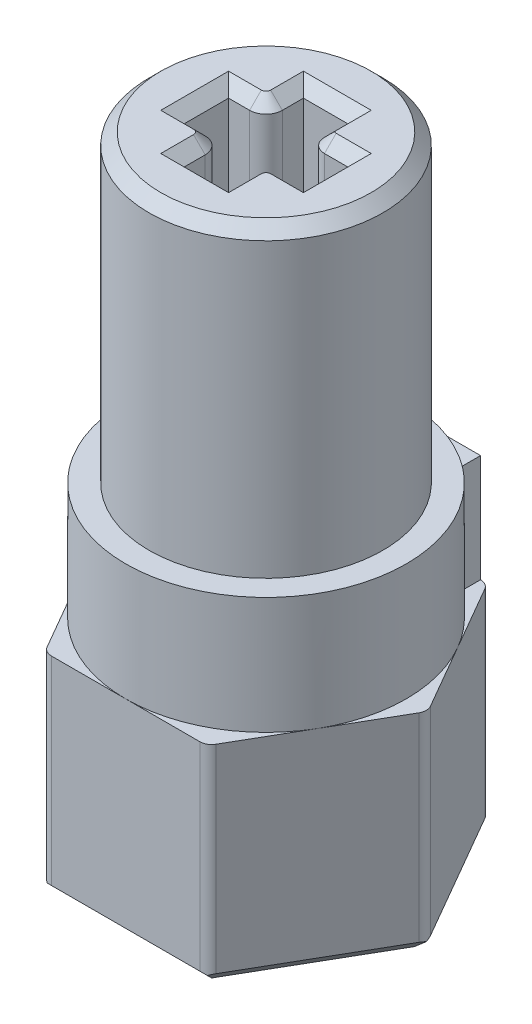
from build123d import *

# Parameters (mm, degrees)
SKETCH_1_R          = 6
EXTRUDE_4_DEPTH     = 18
FILLET_1_R          = 0.6
FILLET_6_R          = 0.7
EXTRUDE_5_DEPTH     = 9
SKETCH_3_R          = 2.55
CUT_EXTRUDE_1_DEPTH = 6
CHAMFER_1_SIZE      = 0.5
FILLET_4_R          = 0.5
FILLET_5_R          = 0.5
SKETCH_4_W          = 6.329239392
SKETCH_4_H          = 4.6
EXTRUDE_6_DEPTH     = 3.45
SKETCH_5_R          = 1.2
CUT_EXTRUDE_2_DEPTH = 3.45
CUT_EXTRUDE_START   = -13
SKETCH_7_R          = 6
SKETCH_7_R_2        = 5
CUT_EXTRUDE_4_DEPTH = 13
CHAMFER_2_SIZE      = 0.5


with BuildPart() as part:
    # ｽｹｯﾁ1 → ﾎﾞｽ - 押し出し4 (new body)
    with BuildSketch(Plane(origin=(0, 0, 0), x_dir=(1, 0, 0), z_dir=(0, 1, 0))):
        with Locations(Location((0, 0, 0), (0, 0, 270))):
            Circle(SKETCH_1_R)
        Polygon((-2.55, -0.95), (-2.55, 0.95), (-0.95, 0.95), (-0.95, 2.55), (0.95, 2.55), (0.95, 0.95), (2.55, 0.95), (2.55, -0.95), (0.95, -0.95), (0.95, -2.55), (-0.95, -2.55), (-0.95, -0.95), align=None, mode=Mode.SUBTRACT)
    extrude(amount=EXTRUDE_4_DEPTH)

    # ﾌｨﾚｯﾄ1
    fillet_1_edges = [part.edges().sort_by_distance(p)[0] for p in [
        (0.95, 9, -0.95),
    ]]
    fillet(fillet_1_edges, radius=FILLET_1_R)

    # ﾌｨﾚｯﾄ6
    fillet_6_edges = [part.edges().sort_by_distance(p)[0] for p in [
        (-0.95, 9, -0.95),
        (-0.95, 9, 0.95),
        (0.95, 9, 0.95),
    ]]
    fillet(fillet_6_edges, radius=FILLET_6_R)

    # ｽｹｯﾁ2 → ﾎﾞｽ - 押し出し5 (add)
    with BuildSketch(Plane.XZ):
        Polygon((6.92820323, 0), (3.464101615, 6), (-3.464101615, 6), (-6.92820323, 0), (-3.464101615, -6), (3.464101615, -6), align=None)
    extrude(amount=EXTRUDE_5_DEPTH)

    # ｽｹｯﾁ3 → ｶｯﾄ - 押し出し1 (cut)
    with BuildSketch(Plane.XZ.offset(9)):
        with Locations(Location((0, 0, 0), (0, 0, 270))):
            Circle(SKETCH_3_R)
    extrude(amount=-CUT_EXTRUDE_1_DEPTH, mode=Mode.SUBTRACT)

    # 面取り1
    chamfer_1_edges = [part.edges().sort_by_distance(p)[0] for p in [
        (0, -9, 2.55),
        (5.196152423, -9, -3),
        (5.196152423, -9, 3),
        (0, -9, 6),
        (-5.196152423, -9, 3),
        (-5.196152423, -9, -3),
        (0, -9, -6),
    ]]
    chamfer(chamfer_1_edges, length=CHAMFER_1_SIZE)

    # ﾌｨﾚｯﾄ4
    fillet_4_edges = [part.edges().sort_by_distance(p)[0] for p in [
        (-3.464101615, -4.25, 6),
    ]]
    fillet(fillet_4_edges, radius=FILLET_4_R)

    # ﾌｨﾚｯﾄ5
    fillet_5_edges = [part.edges().sort_by_distance(p)[0] for p in [
        (3.464101615, -4.25, -6),
        (-3.464101615, -4.25, -6),
        (-6.92820323, -4.25, 0),
        (3.464101615, -4.25, 6),
        (6.92820323, -4.25, 0),
    ]]
    fillet(fillet_5_edges, radius=FILLET_5_R)

    # ｽｹｯﾁ4 → ﾎﾞｽ - 押し出し6 (add)
    with BuildSketch(Plane.XY.offset(-2.55)):
        with Locations((0.010806785, 2.3)):
            Rectangle(SKETCH_4_W, SKETCH_4_H)
    extrude(amount=-EXTRUDE_6_DEPTH)

    # ｽｹｯﾁ5 → ｶｯﾄ - 押し出し2 (cut)
    with BuildSketch(Plane(origin=(0, 0, -6), x_dir=(-1, 0, 0), z_dir=(0, 0, -1))):
        with Locations((0, 2)):
            Circle(SKETCH_5_R)
    extrude(amount=-CUT_EXTRUDE_2_DEPTH, mode=Mode.SUBTRACT)

    # ｽｹｯﾁ7 → ｶｯﾄ - 押し出し4 (cut)
    with BuildSketch(Plane(origin=(0, 18, 0), x_dir=(1, 0, 0), z_dir=(0, 1, 0)).offset(CUT_EXTRUDE_START)):
        with Locations(Location((0, 0, 0), (0, 0, 270))):
            Circle(SKETCH_7_R)
        with Locations(Location((0, 0, 0), (0, 0, 270))):
            Circle(SKETCH_7_R_2, mode=Mode.SUBTRACT)
    extrude(amount=CUT_EXTRUDE_4_DEPTH, mode=Mode.SUBTRACT)

    # 面取り2
    chamfer_2_edges = [part.edges().sort_by_distance(p)[0] for p in [
        (0, 18, -5),
        (2.55, 18, 0),
        (-2.1, 18, -0.95),
        (-2.1, 18, 0.95),
        (-2.55, 18, 0),
        (2.05, 18, -0.95),
        (1.125735931, 18, -1.125735931),
        (-0.95, 18, 2.1),
        (2.1, 18, 0.95),
        (0.95, 18, 2.1),
        (1.155025253, 18, 1.155025253),
        (-1.155025253, 18, -1.155025253),
        (-1.155025253, 18, 1.155025253),
        (0.95, 18, -2.05),
        (0, 18, -2.55),
        (0, 18, 2.55),
        (-0.95, 18, -2.1),
    ]]
    chamfer(chamfer_2_edges, length=CHAMFER_2_SIZE)


solid = part.part
